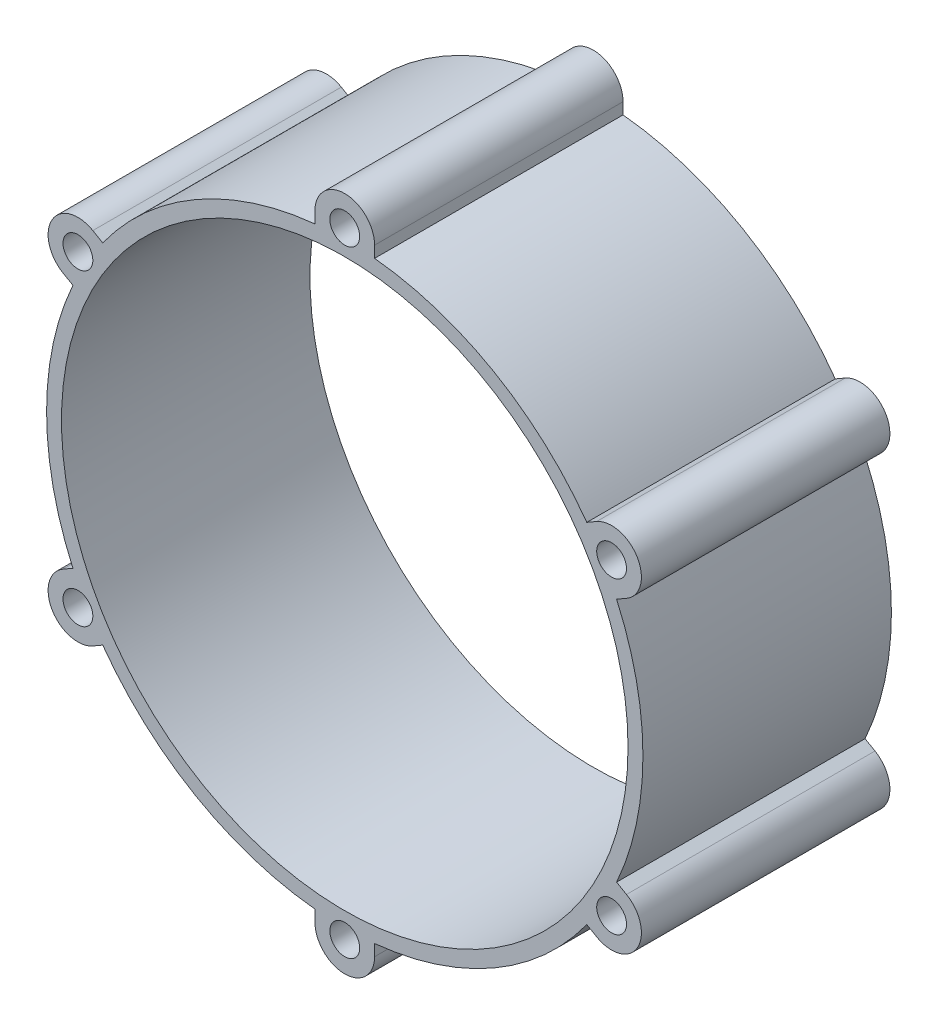
from build123d import *

# Parameters (mm, degrees)
SKETCH1_R           = 57
BOSS_EXTRUDE1_DEPTH = 25
SKETCH3_R           = 3
CUT_EXTRUDE1_DEPTH  = 104.556747728
CIRPATTERN1_COUNT   = 6


with BuildPart() as part:
    # Sketch1 → Boss-Extrude1 (new, symmetric)
    with BuildSketch(Plane.XY):
        with BuildLine():
            Line((6, 59.699246226), (6, 62))
            ThreePointArc((6, 62), (0, 68), (-6, 62))
            Line((-6, 62), (-6, 59.699246226))
            ThreePointArc((-6, 59.699246226), (-30, 51.961524227), (-48.701063819, 35.045775536))
            Line((-48.701063819, 35.045775536), (-50.693575035, 36.196152423))
            ThreePointArc((-50.693575035, 36.196152423), (-58.889727457, 34), (-56.693575035, 25.803847577))
            Line((-56.693575035, 25.803847577), (-54.701063819, 24.65347069))
            ThreePointArc((-54.701063819, 24.65347069), (-60, 0), (-54.701063819, -24.65347069))
            Line((-54.701063819, -24.65347069), (-56.693575035, -25.803847577))
            ThreePointArc((-56.693575035, -25.803847577), (-58.889727457, -34), (-50.693575035, -36.196152423))
            Line((-50.693575035, -36.196152423), (-48.701063819, -35.045775536))
            ThreePointArc((-48.701063819, -35.045775536), (-30, -51.961524227), (-6, -59.699246226))
            Line((-6, -59.699246226), (-6, -62))
            ThreePointArc((-6, -62), (0, -68), (6, -62))
            Line((6, -62), (6, -59.699246226))
            ThreePointArc((6, -59.699246226), (30, -51.961524227), (48.701063819, -35.045775536))
            Line((48.701063819, -35.045775536), (50.693575035, -36.196152423))
            ThreePointArc((50.693575035, -36.196152423), (58.889727457, -34), (56.693575035, -25.803847577))
            Line((56.693575035, -25.803847577), (54.701063819, -24.65347069))
            ThreePointArc((54.701063819, -24.65347069), (60, 0), (54.701063819, 24.65347069))
            Line((54.701063819, 24.65347069), (56.693575035, 25.803847577))
            ThreePointArc((56.693575035, 25.803847577), (58.889727457, 34), (50.693575035, 36.196152423))
            Line((50.693575035, 36.196152423), (48.701063819, 35.045775536))
            ThreePointArc((48.701063819, 35.045775536), (30, 51.961524227), (6, 59.699246226))
        make_face()
        Circle(SKETCH1_R, mode=Mode.SUBTRACT)
    extrude(amount=BOSS_EXTRUDE1_DEPTH, both=True)

    # Sketch3 → Cut-Extrude1 (cut, through all)
    with BuildSketch(Plane(origin=(0, 0, -25), x_dir=(-1, 0, 0), z_dir=(0, 0, -1))):
        with Locations((0, 62)):
            Circle(SKETCH3_R)
    cut_extrude1 = extrude(amount=-CUT_EXTRUDE1_DEPTH, mode=Mode.SUBTRACT)

    # CirPattern1: Cut-Extrude1 ×6 about axis
    cirpattern1_axis = Axis((0, 0, 0), (0, 0, 1))
    for i in range(1, CIRPATTERN1_COUNT):
        add(cut_extrude1.rotate(cirpattern1_axis, i * 360 / CIRPATTERN1_COUNT), mode=Mode.SUBTRACT)


solid = part.part
